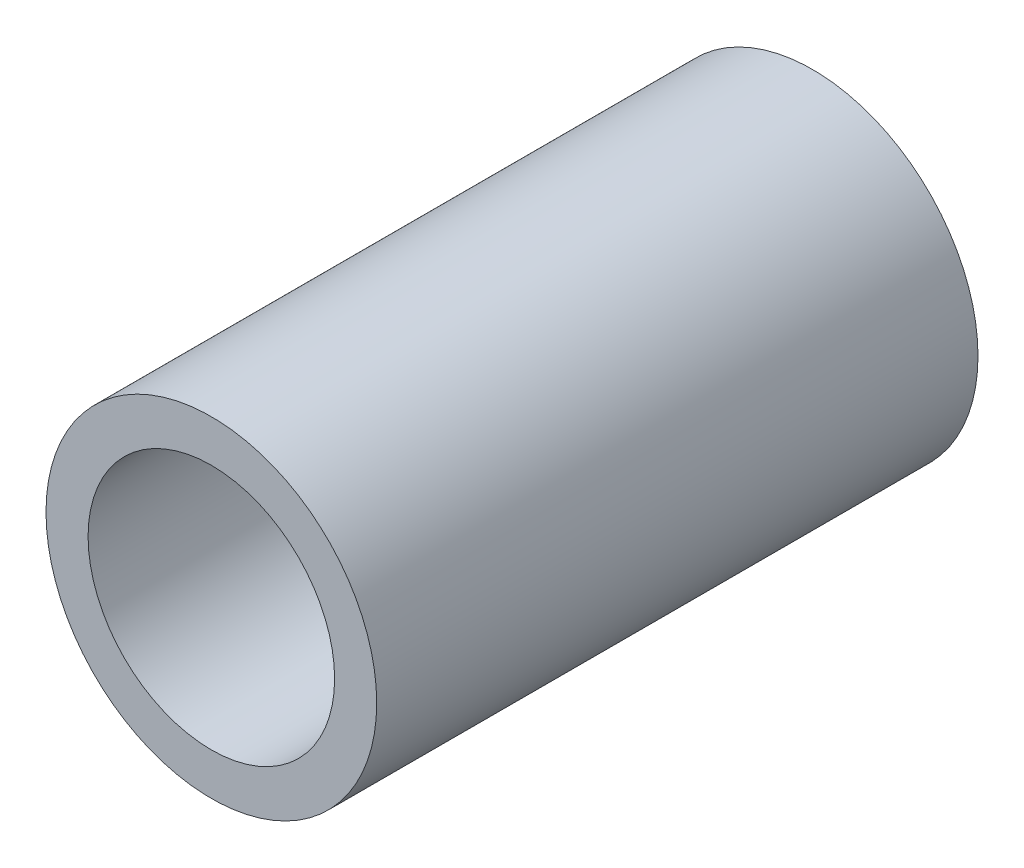
from build123d import *

# Parameters (mm, degrees)
SKETCH_1_R      = 4.125
SKETCH_1_R_2    = 3.075
EXTRUDE_1_DEPTH = 15


with BuildPart() as part:
    # 草图1 → 凸台-拉伸1 (new body)
    with BuildSketch(Plane.XY):
        Circle(SKETCH_1_R)
        Circle(SKETCH_1_R_2, mode=Mode.SUBTRACT)
    extrude(amount=EXTRUDE_1_DEPTH)


solid = part.part
